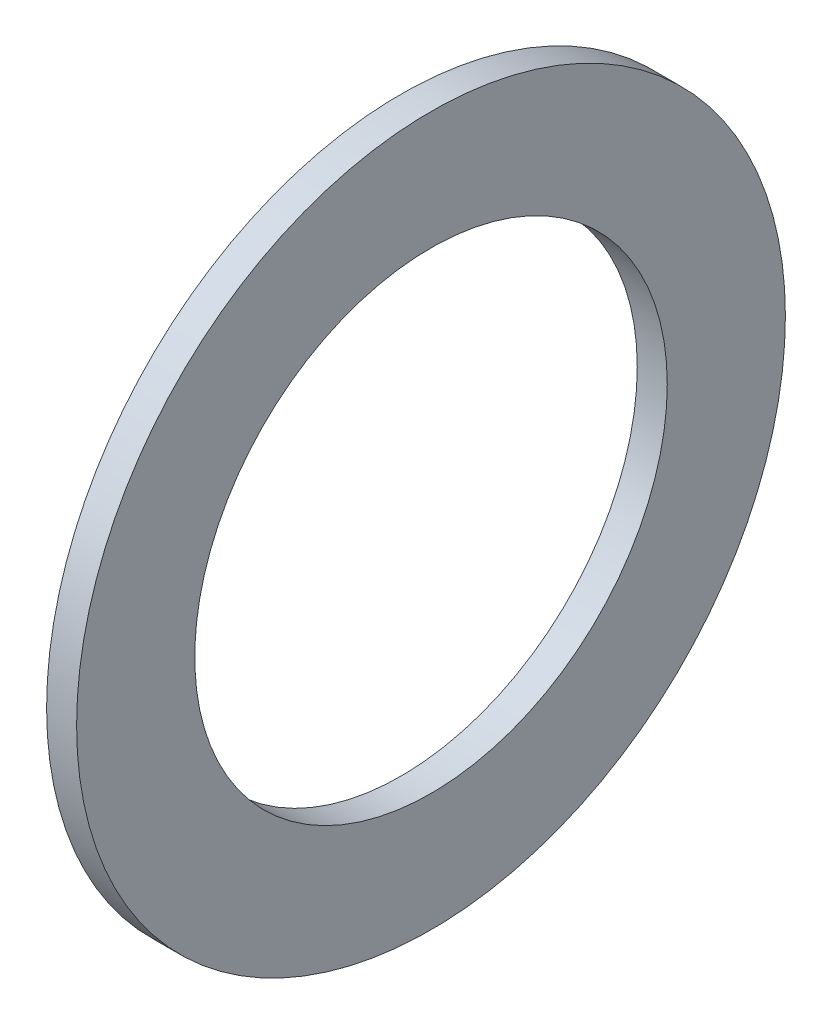
from build123d import *

# Parameters (mm, degrees)
SKETCH1_R           = 6
SKETCH1_R_2         = 4
BOSS_EXTRUDE1_DEPTH = 0.508


with BuildPart() as part:
    # Sketch1 → Boss-Extrude1 (new body)
    with BuildSketch(Plane(origin=(0, 0, 0), x_dir=(0, 0, -1), z_dir=(1, 0, 0))):
        Circle(SKETCH1_R)
        Circle(SKETCH1_R_2, mode=Mode.SUBTRACT)
    extrude(amount=BOSS_EXTRUDE1_DEPTH)


solid = part.part
